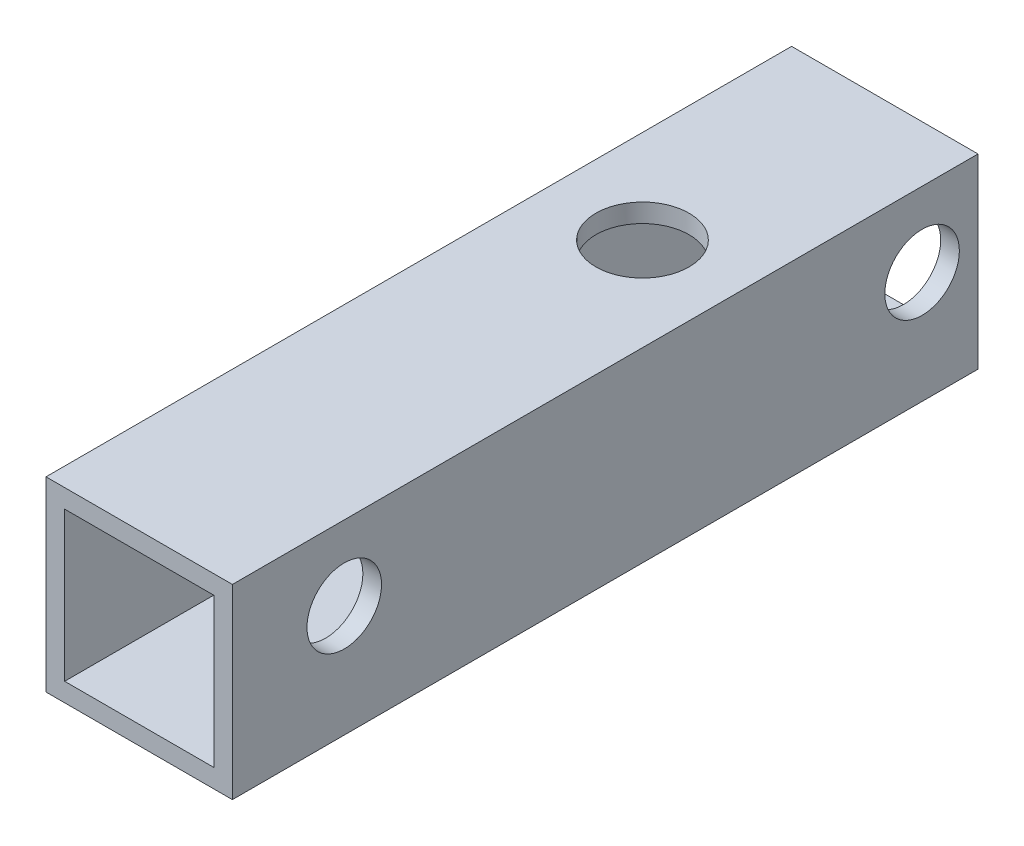
from build123d import *

# Parameters (mm, degrees)
SKIZZE1_W                       = 10
SKIZZE1_H                       = 10
SKIZZE1_W_2                     = 8
SKIZZE1_H_2                     = 8
AUFSATZ_LINEAR_AUSTRAGEN1_DEPTH = 40
SKIZZE2_R                       = 2
SCHNITT_LINEAR_AUSTRAGEN1_DEPTH = 42.533119315
SKIZZE3_R                       = 2.5
SCHNITT_LINEAR_AUSTRAGEN2_DEPTH = 17


with BuildPart() as part:
    # Skizze1 → Aufsatz-Linear austragen1 (new body)
    with BuildSketch(Plane.XY):
        Rectangle(SKIZZE1_W, SKIZZE1_H)
        Rectangle(SKIZZE1_W_2, SKIZZE1_H_2, mode=Mode.SUBTRACT)
    extrude(amount=AUFSATZ_LINEAR_AUSTRAGEN1_DEPTH)

    # Skizze2 → Schnitt-Linear austragen1 (cut, through all)
    with BuildSketch(Plane(origin=(5, 0, 0), x_dir=(0, 0, -1), z_dir=(1, 0, 0))):
        with Locations((-34, 1)):
            Circle(SKIZZE2_R)
        with Locations((-3, 1)):
            Circle(SKIZZE2_R)
    extrude(amount=-SCHNITT_LINEAR_AUSTRAGEN1_DEPTH, mode=Mode.SUBTRACT)

    # Skizze3 → Schnitt-Linear austragen2 (cut)
    with BuildSketch(Plane(origin=(0, 5, 0), x_dir=(1, 0, 0), z_dir=(0, 1, 0))):
        with Locations(Location((0, -13, 0), (0, 0, 270))):
            Circle(SKIZZE3_R)
    extrude(amount=-SCHNITT_LINEAR_AUSTRAGEN2_DEPTH, mode=Mode.SUBTRACT)


solid = part.part
